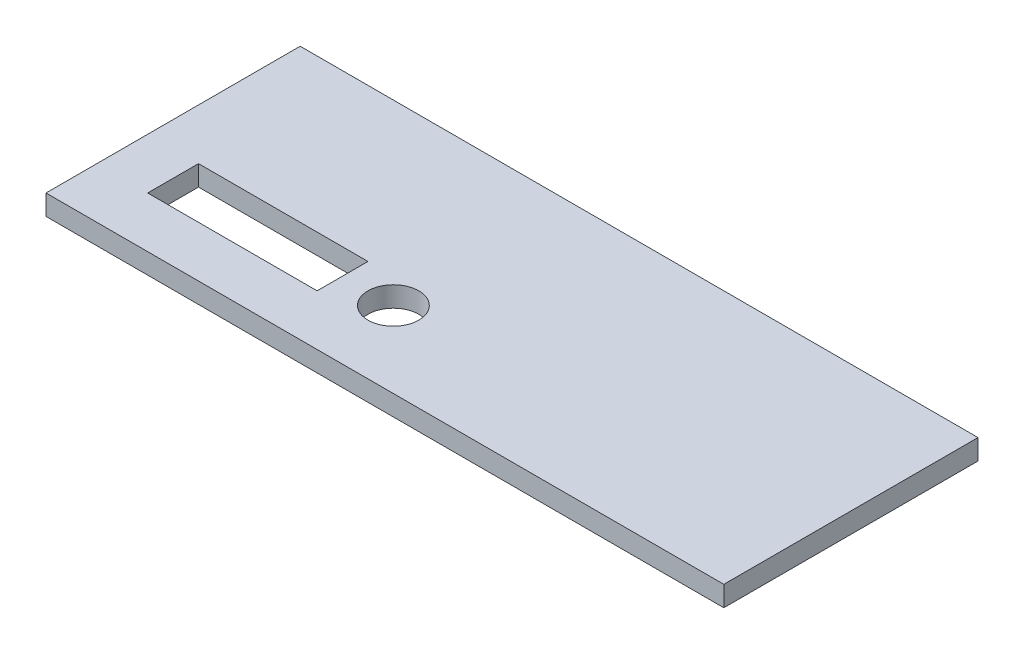
from build123d import *

# Parameters (mm, degrees)
SKETCH1_W           = 200
SKETCH1_H           = 75
BOSS_EXTRUDE1_DEPTH = 6
SKETCH2_R           = 7.5
SKETCH2_W           = 50
SKETCH2_H           = 15
CUT_EXTRUDE1_DEPTH  = 214.684346642


with BuildPart() as part:
    # Sketch1 → Boss-Extrude1 (new body)
    with BuildSketch(Plane(origin=(0, 0, 0), x_dir=(1, 0, 0), z_dir=(0, 1, 0))):
        with Locations((100, 37.5)):
            Rectangle(SKETCH1_W, SKETCH1_H)
    extrude(amount=BOSS_EXTRUDE1_DEPTH)

    # Sketch2 → Cut-Extrude1 (cut, through all)
    with BuildSketch(Plane(origin=(0, 6, 0), x_dir=(1, 0, 0), z_dir=(0, 1, 0))):
        with Locations(Location((80, 22.5, 0), (0, 0, 270))):
            Circle(SKETCH2_R)
        with Locations((40, 22.5)):
            Rectangle(SKETCH2_W, SKETCH2_H)
    extrude(amount=-CUT_EXTRUDE1_DEPTH, mode=Mode.SUBTRACT)


solid = part.part
